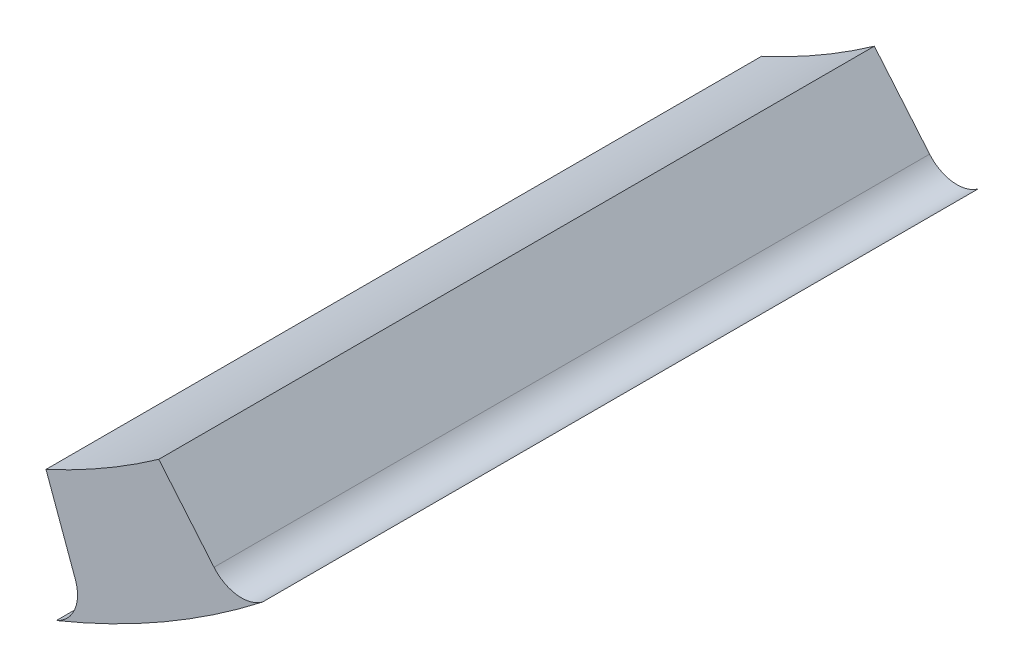
from build123d import *

# Parameters (mm, degrees)
BOSS_EXTRUDE1_START = -60
BOSS_EXTRUDE1_DEPTH = 60


with BuildPart() as part:
    # Sketch1 → Boss-Extrude1 (new body)
    with BuildSketch(Plane.XY.offset(BOSS_EXTRUDE1_START)):
        with BuildLine():
            ThreePointArc((34.60288698, -49.016734007), (30, -51.961524227), (25.14829337, -54.475346172))
            Line((25.14829337, -54.475346172), (27.613812707, -61.249304876))
            ThreePointArc((27.613812707, -61.249304876), (27.55707569, -63.445610174), (26.01881055, -65.014277255))
            ThreePointArc((26.01881055, -65.014277255), (34.999997878, -60.621774589), (43.294610437, -55.040089541))
            ThreePointArc((43.294610437, -55.040089541), (41.166972324, -55.587932689), (39.236547633, -54.538915737))
            Line((39.236547633, -54.538915737), (34.60288698, -49.016734007))
        make_face()
    extrude(amount=BOSS_EXTRUDE1_DEPTH)


solid = part.part
